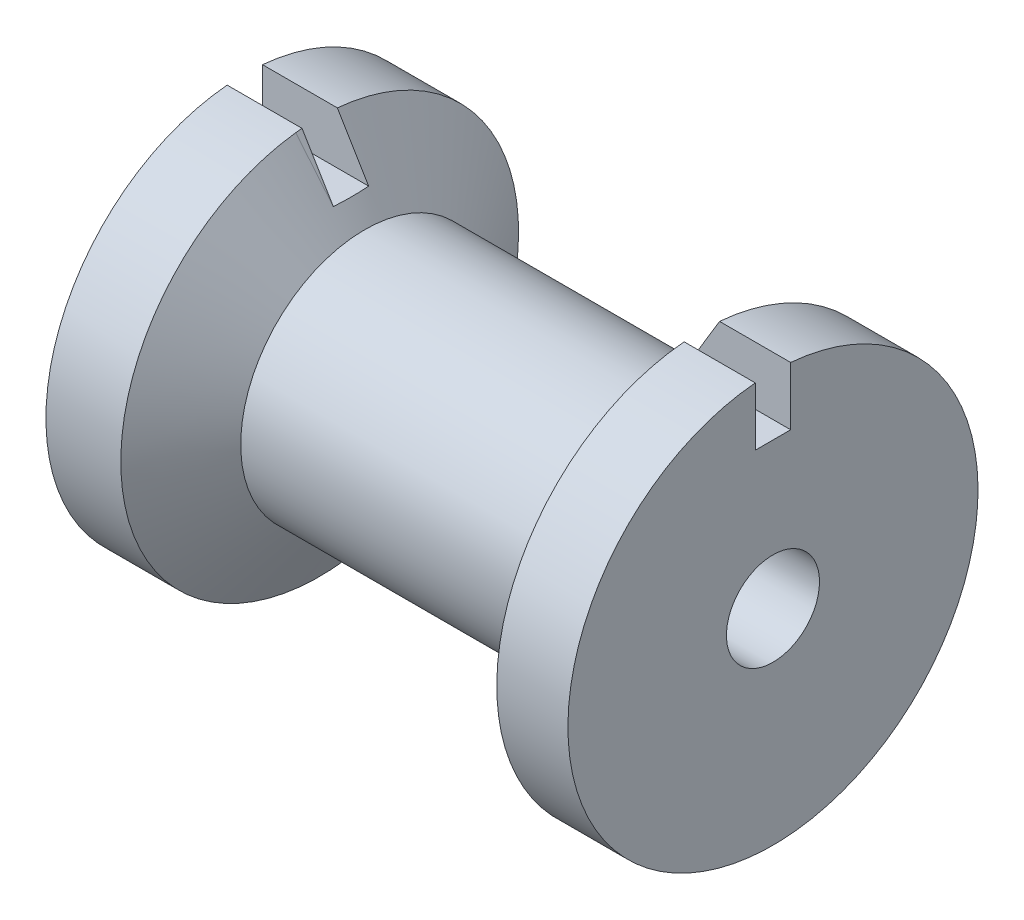
from build123d import *

# Parameters (mm, degrees)
SKETCH2_R          = 4
SKETCH2_W          = 3.042289544
SKETCH2_H          = 10.155281322
CUT_EXTRUDE1_DEPTH = 52.796856473


with BuildPart() as part:
    # Sketch1 → Revolve2 (revolve)
    with BuildSketch(Plane.XY, mode=Mode.PRIVATE) as revolve2_sk:
        Polygon((-12.385789017, 10.66911418), (-16.266149841, 17.097592899), (-22.701695292, 17.097592899), (-22.701695292, 0), (22.701695292, 0), (22.701695292, 17.627343304), (16.585917987, 17.627343304), (12.385789017, 10.66911418), align=None)
    revolve(revolve2_sk.sketch.rotate(Axis((22.701695292, 0, 0), (-1, 0, 0)), 90), axis=Axis((22.701695292, 0, 0), (-1, 0, 0)))

    # Sketch2 → Cut-Extrude1 (cut, through all)
    with BuildSketch(Plane(origin=(22.701695292, 0, 0), x_dir=(0, 0, -1), z_dir=(1, 0, 0))):
        Circle(SKETCH2_R)
        with Locations((0, 17.627343304)):
            Rectangle(SKETCH2_W, SKETCH2_H)
    extrude(amount=-CUT_EXTRUDE1_DEPTH, mode=Mode.SUBTRACT)


solid = part.part
